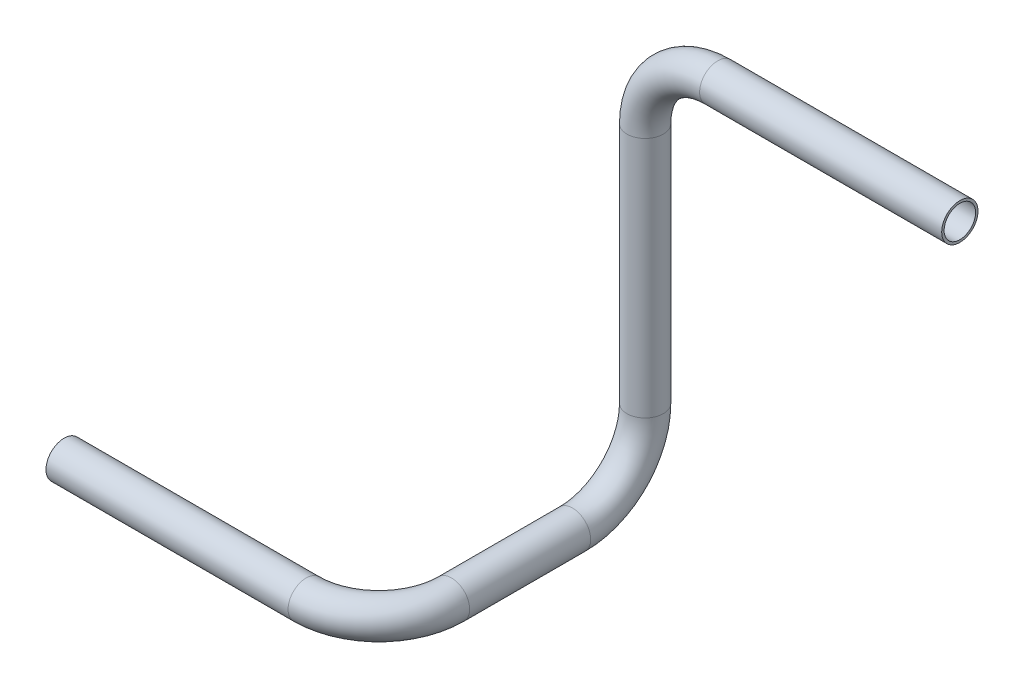
from build123d import *

# Parameters (mm, degrees)
SWEEP_THIN1_PROFILE_R   = 15
SWEEP_THIN1_PROFILE_R_2 = 13


with BuildPart() as part:
    # Sweep-Thin1: sweep along a curve in space
    with BuildLine() as sweep_thin1_path:
        Line((0, 0, 0), (200, 0, 0))
        ThreePointArc((200, 0, 0), (242.426406871, 0, -17.573593129), (260, 0, -60))
        Line((260, 0, -60), (260, 0, -160))
        ThreePointArc((260, 0, -160), (260, 17.573593129, -202.426406871), (260, 60, -220))
        Line((260, 60, -220), (260, 260, -220))
        ThreePointArc((260, 260, -220), (277.573593129, 302.426406871, -220), (320, 320, -220))
        Line((320, 320, -220), (520, 320, -220))
    # Sweep-Thin1 profile (on start of the path) → Sweep-Thin1 (sweep)
    with BuildSketch(Plane(origin=(0, 0, 0), x_dir=(0, 0, 1), z_dir=(1, 0, 0))):
        Circle(SWEEP_THIN1_PROFILE_R)
        Circle(SWEEP_THIN1_PROFILE_R_2, mode=Mode.SUBTRACT)
    sweep(path=sweep_thin1_path.line)


solid = part.part
